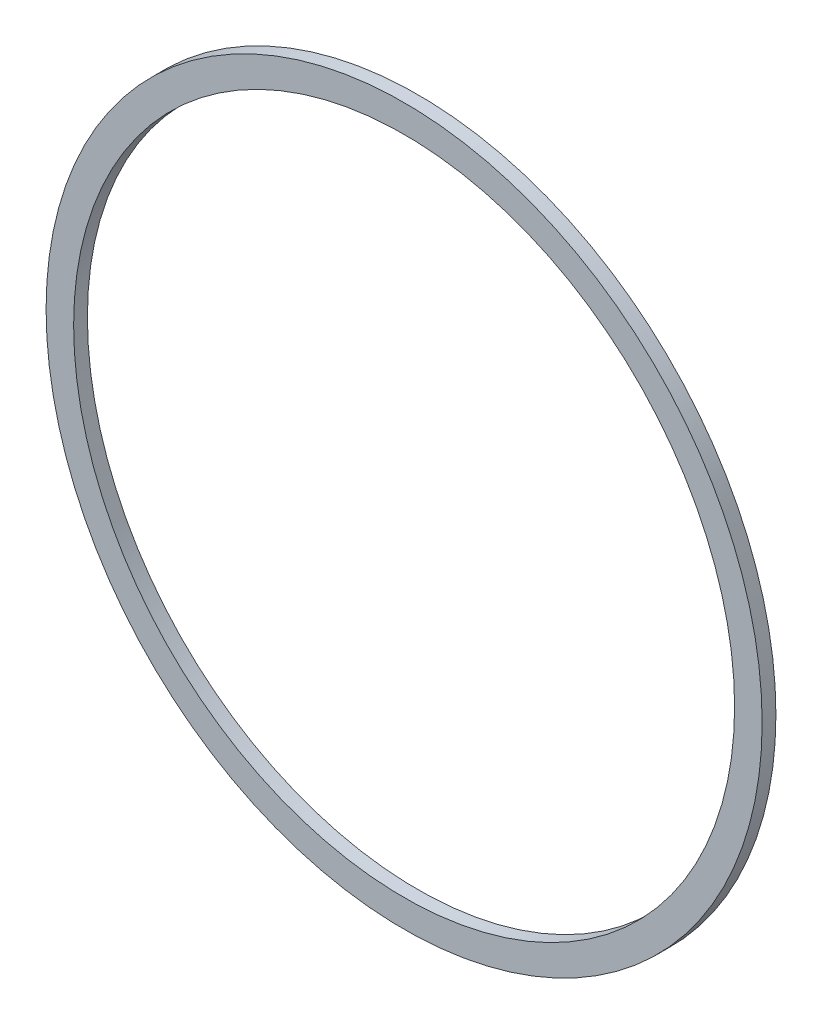
from build123d import *

# Parameters (mm, degrees)
SKETCH_1_R      = 26
SKETCH_1_R_2    = 24
EXTRUDE_1_DEPTH = 1


with BuildPart() as part:
    # 草图1 → 拉伸1 (new body)
    with BuildSketch(Plane.XY):
        Circle(SKETCH_1_R)
        Circle(SKETCH_1_R_2, mode=Mode.SUBTRACT)
    extrude(amount=EXTRUDE_1_DEPTH)


solid = part.part
